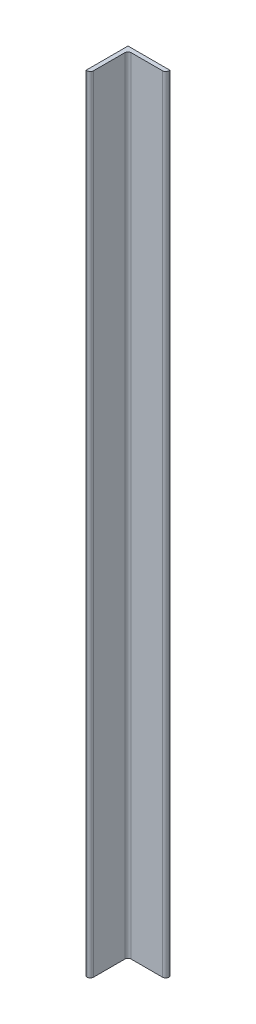
from build123d import *

# Parameters (mm, degrees)
BOSS_EXTRUDE1_DEPTH = 750


with BuildPart() as part:
    # Sketch1 → Boss-Extrude1 (new body)
    with BuildSketch(Plane(origin=(0, 0, 0), x_dir=(1, 0, 0), z_dir=(0, 1, 0))):
        with BuildLine():
            Line((-27.499872145, 29.213153277), (-67.499872145, 29.213153277))
            Line((-67.499872145, 29.213153277), (-67.499872145, -10.786846723))
            Line((-67.499872145, -10.786846723), (-66.499872145, -10.786846723))
            ThreePointArc((-66.499872145, -10.786846723), (-64.378551801, -9.908167067), (-63.499872145, -7.786846723))
            Line((-63.499872145, -7.786846723), (-63.499872145, 22.213153277))
            ThreePointArc((-63.499872145, 22.213153277), (-62.621192489, 24.334473621), (-60.499872145, 25.213153277))
            Line((-60.499872145, 25.213153277), (-30.499872145, 25.213153277))
            ThreePointArc((-30.499872145, 25.213153277), (-28.378551801, 26.091832933), (-27.499872145, 28.213153277))
            Line((-27.499872145, 28.213153277), (-27.499872145, 29.213153277))
        make_face()
    extrude(amount=BOSS_EXTRUDE1_DEPTH)


solid = part.part
